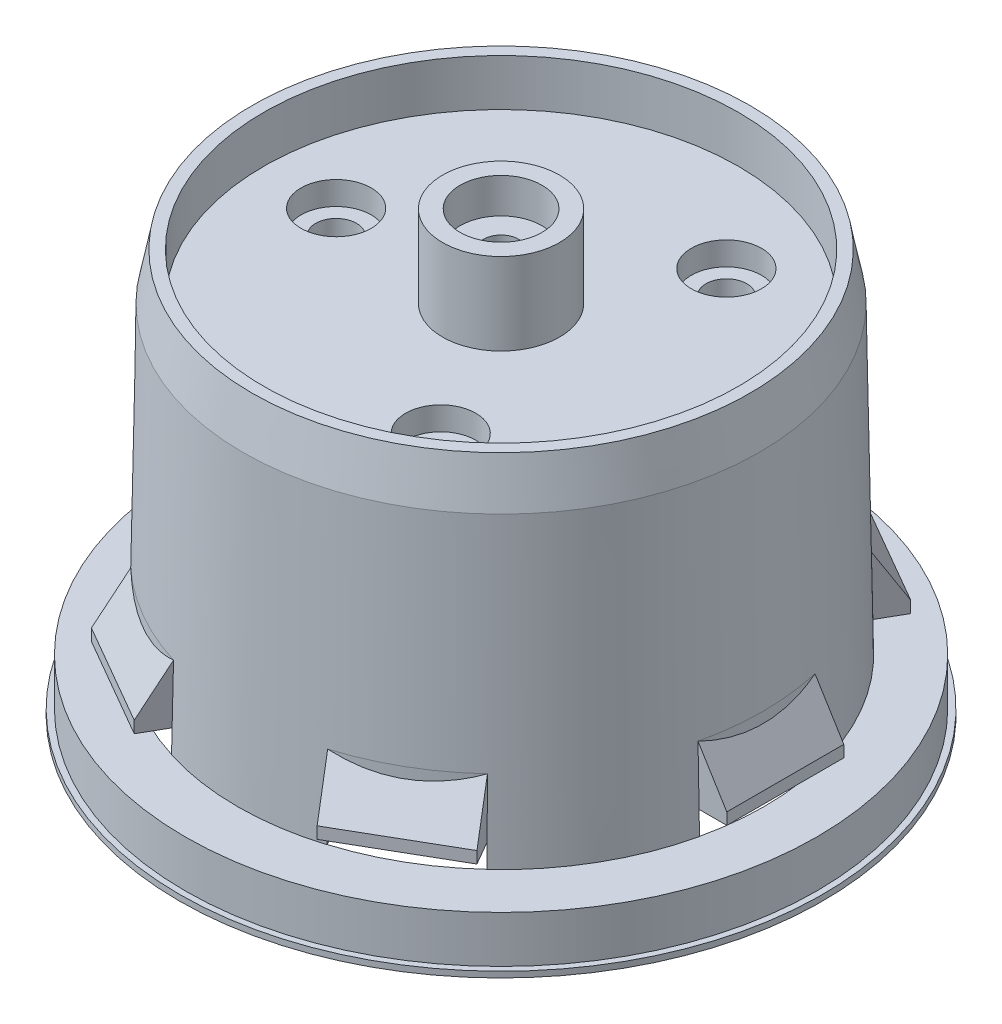
from build123d import *

# Parameters (mm, degrees)
SCHIZZO1_R                    = 22
ESTRUSIONE_ESTRUSIONE1_DEPTH  = 30
SFORMO1_ANGLE                 = 1
SMUSSO1_SIZE                  = 4
SMUSSO1_SIZE2                 = 0.707593191
SCHIZZO2_R                    = 20.292406809
TAGLIO_ESTRUSIONE1_DEPTH      = 4
SVUOTA1_T                     = -3
SCHIZZO4_R                    = 3
TAGLIO_ESTRUSIONE2_DEPTH      = 2
SCHIZZO5_R                    = 1.75
TAGLIO_ESTRUSIONE3_DEPTH      = 40.882700437
RIPETIZIONECIRCOLARE1_COUNT   = 3
SCHIZZO3_R                    = 5
ESTRUSIONE_ESTRUSIONE2_DEPTH  = 7
SCHIZZO6_R                    = 3.5
TAGLIO_ESTRUSIONE5_DEPTH      = 3
SCHIZZO8_W                    = 1
SCHIZZO8_H                    = 40.584813618
ESTRUSIONE_SOTTILE1_DEPTH     = 8
SCHIZZO7_R                    = 2.5
SCHIZZO7_R_2                  = 1.5
ESTRUSIONE_ESTRUSIONE5_DEPTH  = 17
SCHIZZO10_R                   = 1.5
TAGLIO_ESTRUSIONE7_DEPTH      = 44.75648295
SCHIZZO11_R                   = 0.75
ESTRUSIONE_ESTRUSIONE6_DEPTH  = 8
RIPETIZIONECIRCOLARE2_COUNT   = 6
SCHIZZO12_R                   = 3.5
SCHIZZO12_R_2                 = 1.75
ESTRUSIONE_ESTRUSIONE7_DEPTH  = 5
TAGLIO_ESTRUSIONE8_START      = -1.5
SCHIZZO13_R                   = 3
TAGLIO_ESTRUSIONE8_DEPTH      = 1.5
RIPETIZIONECIRCOLARE3_COUNT   = 3
SCHIZZO14_R                   = 27
SCHIZZO14_R_2                 = 22.5
ESTRUSIONE_ESTRUSIONE8_DEPTH  = 4
SCHIZZO16_R                   = 27.5
SCHIZZO16_R_2                 = 26.5
ESTRUSIONE_ESTRUSIONE9_DEPTH  = 0.5
SCHIZZO17_W                   = 2
SCHIZZO17_H                   = 10
TAGLIO_ESTRUSIONE9_DEPTH      = 4
SCHIZZO18_W                   = 5
SCHIZZO18_H                   = 10
ESTRUSIONE_ESTRUSIONE10_DEPTH = 2
TAGLIO_ESTRUSIONE10_DEPTH     = 10
ESTRUSIONE_ESTRUSIONE11_DEPTH = 1
RIPETIZIONECIRCOLARE11_COUNT  = 6


with BuildPart() as part:
    # Schizzo1 → Estrusione-Estrusione1 (new body)
    with BuildSketch(Plane(origin=(0, 0, 0), x_dir=(1, 0, 0), z_dir=(0, 1, 0))):
        with Locations(Location((0, 0, 0), (0, 0, 270))):
            Circle(SCHIZZO1_R)
    extrude(amount=ESTRUSIONE_ESTRUSIONE1_DEPTH)

    # Sformo1
    sformo1_faces = [part.faces().sort_by_distance(p)[0] for p in [
        (0, 15, -22),
    ]]
    draft(sformo1_faces, Plane.ZX.offset(30), SFORMO1_ANGLE)

    # Smusso1
    smusso1_edges = [part.edges().sort_by_distance(p)[0] for p in [
        (0, 30, -22),
    ]]
    smusso1_side = [part.faces().sort_by_distance(p)[0] for p in [
        (0, 15, -22.261825974),
    ]]
    chamfer(smusso1_edges, length=SMUSSO1_SIZE, length2=SMUSSO1_SIZE2, reference=smusso1_side[0])

    # Schizzo2 → Taglio-Estrusione1 (cut)
    with BuildSketch(Plane(origin=(0, 30, 0), x_dir=(1, 0, 0), z_dir=(0, 1, 0))):
        with Locations(Location((0, 0, 0), (0, 0, 270))):
            Circle(SCHIZZO2_R)
    extrude(amount=-TAGLIO_ESTRUSIONE1_DEPTH, mode=Mode.SUBTRACT)

    # Svuota1
    svuota1_openings = [part.faces().sort_by_distance(p)[0] for p in [
        (0, 0, 0),
    ]]
    offset(amount=SVUOTA1_T, openings=svuota1_openings, kind=Kind.INTERSECTION)

    # Schizzo4 → Taglio-Estrusione2 (cut)
    with BuildSketch(Plane(origin=(0, 26, 0), x_dir=(1, 0, 0), z_dir=(0, 1, 0))):
        with Locations(Location((7.05, 12.210958193, 0), (0, 0, 270))):
            Circle(SCHIZZO4_R)
    taglio_estrusione2 = extrude(amount=-TAGLIO_ESTRUSIONE2_DEPTH, mode=Mode.SUBTRACT)

    # Schizzo5 → Taglio-Estrusione3 (cut, through all)
    with BuildSketch(Plane(origin=(0, 24, 0), x_dir=(1, 0, 0), z_dir=(0, 1, 0))):
        with Locations(Location((7.05, 12.210958193, 0), (0, 0, 270))):
            Circle(SCHIZZO5_R)
    taglio_estrusione3 = extrude(amount=-TAGLIO_ESTRUSIONE3_DEPTH, mode=Mode.SUBTRACT)

    # RipetizioneCircolare1: Taglio-Estrusione2, Taglio-Estrusione3 ×3 about axis
    ripetizionecircolare1_axis = Axis((0, 0, 0), (0, 1, 0))
    add([taglio_estrusione2.rotate(ripetizionecircolare1_axis, i * 360 / RIPETIZIONECIRCOLARE1_COUNT) for i in range(1, RIPETIZIONECIRCOLARE1_COUNT)], mode=Mode.SUBTRACT)
    add([taglio_estrusione3.rotate(ripetizionecircolare1_axis, i * 360 / RIPETIZIONECIRCOLARE1_COUNT) for i in range(1, RIPETIZIONECIRCOLARE1_COUNT)], mode=Mode.SUBTRACT)

    # Schizzo3 → Estrusione-Estrusione2 (add)
    with BuildSketch(Plane(origin=(0, 26, 0), x_dir=(1, 0, 0), z_dir=(0, 1, 0))):
        with Locations(Location((0, 0, 0), (0, 0, 270))):
            Circle(SCHIZZO3_R)
    extrude(amount=ESTRUSIONE_ESTRUSIONE2_DEPTH)

    # Schizzo6 → Taglio-Estrusione5 (cut)
    with BuildSketch(Plane(origin=(0, 33, 0), x_dir=(1, 0, 0), z_dir=(0, 1, 0))):
        with Locations(Location((0, 0, 0), (0, 0, 270))):
            Circle(SCHIZZO6_R)
    extrude(amount=-TAGLIO_ESTRUSIONE5_DEPTH, mode=Mode.SUBTRACT)

    # Schizzo8 → Estrusione-Sottile1 (add)
    with BuildSketch(Plane.XZ.offset(-23)):
        Polygon((-17.323739801, -10.579216107), (17.823739801, 9.713190703), (17.323739801, 10.579216107), (-17.823739801, -9.713190703), align=None)
        Rectangle(SCHIZZO8_W, SCHIZZO8_H)
        Polygon((17.823739801, -9.713190703), (-17.323739801, 10.579216107), (-17.823739801, 9.713190703), (17.323739801, -10.579216107), align=None)
    extrude(amount=ESTRUSIONE_SOTTILE1_DEPTH)

    # Schizzo7 → Estrusione-Estrusione5 (add)
    with BuildSketch(Plane(origin=(0, 30, 0), x_dir=(1, 0, 0), z_dir=(0, 1, 0))):
        with Locations(Location((0, 0, 0), (0, 0, 270))):
            Circle(SCHIZZO7_R)
        with Locations(Location((0, 0, 0), (0, 0, 270))):
            Circle(SCHIZZO7_R_2, mode=Mode.SUBTRACT)
    extrude(amount=-ESTRUSIONE_ESTRUSIONE5_DEPTH)

    # Schizzo10 → Taglio-Estrusione7 (cut, through all)
    with BuildSketch(Plane(origin=(0, 30, 0), x_dir=(1, 0, 0), z_dir=(0, 1, 0))):
        with Locations(Location((0, 0, 0), (0, 0, 270))):
            Circle(SCHIZZO10_R)
    extrude(amount=-TAGLIO_ESTRUSIONE7_DEPTH, mode=Mode.SUBTRACT)

    # Schizzo11 → Estrusione-Estrusione6 (add)
    with BuildSketch(Plane.XZ.offset(-15)):
        with Locations((0, -10.852183983)):
            Circle(SCHIZZO11_R)
    estrusione_estrusione6 = extrude(amount=-ESTRUSIONE_ESTRUSIONE6_DEPTH)

    # RipetizioneCircolare2: Estrusione-Estrusione6 ×6 about axis
    ripetizionecircolare2_axis = Axis((0, 0, 0), (0, 1, 0))
    for i in range(1, RIPETIZIONECIRCOLARE2_COUNT):
        add(estrusione_estrusione6.rotate(ripetizionecircolare2_axis, i * 360 / RIPETIZIONECIRCOLARE2_COUNT))

    # Schizzo12 → Estrusione-Estrusione7 (add)
    with BuildSketch(Plane.XZ.offset(-23)):
        with Locations(Location((7.05, -12.210958193, 0), (0, 0, 90))):
            Circle(SCHIZZO12_R)
        with Locations(Location((7.05, -12.210958193, 0), (0, 0, 90))):
            Circle(SCHIZZO12_R_2, mode=Mode.SUBTRACT)
    estrusione_estrusione7 = extrude(amount=ESTRUSIONE_ESTRUSIONE7_DEPTH)

    # Schizzo13 → Taglio-Estrusione8 (cut)
    with BuildSketch(Plane.XZ.offset(-18).offset(TAGLIO_ESTRUSIONE8_START)):
        with Locations(Location((7.05, -12.210958193, 0), (0, 0, 90))):
            Circle(SCHIZZO13_R)
    taglio_estrusione8 = extrude(amount=TAGLIO_ESTRUSIONE8_DEPTH, mode=Mode.SUBTRACT)

    # RipetizioneCircolare3: Estrusione-Estrusione7, Taglio-Estrusione8 ×3 about axis
    ripetizionecircolare3_axis = Axis((0, 0, 0), (0, 1, 0))
    add([estrusione_estrusione7.rotate(ripetizionecircolare3_axis, i * 360 / RIPETIZIONECIRCOLARE3_COUNT) for i in range(1, RIPETIZIONECIRCOLARE3_COUNT)])
    add([taglio_estrusione8.rotate(ripetizionecircolare3_axis, i * 360 / RIPETIZIONECIRCOLARE3_COUNT) for i in range(1, RIPETIZIONECIRCOLARE3_COUNT)], mode=Mode.SUBTRACT)

    # Schizzo14 → Estrusione-Estrusione8 (add)
    with BuildSketch(Plane.XZ):
        with Locations(Location((0, 0, 0), (0, 0, 270))):
            Circle(SCHIZZO14_R)
        with Locations(Location((0, 0, 0), (0, 0, 270))):
            Circle(SCHIZZO14_R_2, mode=Mode.SUBTRACT)
    extrude(amount=ESTRUSIONE_ESTRUSIONE8_DEPTH)

    # Schizzo16 → Estrusione-Estrusione9 (add)
    with BuildSketch(Plane.XZ.offset(4)):
        with Locations(Location((0, 0, 0), (0, 0, 270))):
            Circle(SCHIZZO16_R)
        with Locations(Location((0, 0, 0), (0, 0, 270))):
            Circle(SCHIZZO16_R_2, mode=Mode.SUBTRACT)
    extrude(amount=ESTRUSIONE_ESTRUSIONE9_DEPTH)

    # Schizzo17 → Taglio-Estrusione9 (cut, symmetric)
    with BuildSketch(Plane(origin=(11.148365393, 0, -19.309535283), x_dir=(0, 1, 0), z_dir=(0.499999999999998, 0, -0.8660254037844398))):
        with Locations((1, 0)):
            Rectangle(SCHIZZO17_W, SCHIZZO17_H)
    taglio_estrusione9 = extrude(amount=TAGLIO_ESTRUSIONE9_DEPTH, both=True, mode=Mode.SUBTRACT)

    # Schizzo18 → Estrusione-Estrusione10 (add, symmetric)
    with BuildSketch(Plane(origin=(11.148365393, 0, -19.309535283), x_dir=(0, 1, 0), z_dir=(0.499999999999998, 0, -0.8660254037844398))):
        with Locations((4.5, 0)):
            Rectangle(SCHIZZO18_W, SCHIZZO18_H)
    estrusione_estrusione10 = extrude(amount=ESTRUSIONE_ESTRUSIONE10_DEPTH, both=True)

    # Schizzo19 → Taglio-Estrusione10 (cut)
    with BuildSketch(Plane(origin=(-4.330127019, 0, -2.5), x_dir=(-0.4999999999999981, 0, 0.8660254037844397), z_dir=(-0.8660254037844397, 0, -0.4999999999999981))):
        Polygon((-21.836339003, 7), (-24.296730787, 3), (-24.296730787, 7), align=None)
    taglio_estrusione10 = extrude(amount=-TAGLIO_ESTRUSIONE10_DEPTH, mode=Mode.SUBTRACT)

    # Schizzo20 → Estrusione-Estrusione11 (add)
    with BuildSketch(Plane.XZ.offset(-7)):
        with BuildLine():
            Line((15.24829652, -16.410824302), (6.588042483, -21.410824302))
            ThreePointArc((6.588042483, -21.410824302), (11.200733247, -19.400239065), (15.24829652, -16.410824302))
        make_face()
    estrusione_estrusione11 = extrude(amount=ESTRUSIONE_ESTRUSIONE11_DEPTH)

    # RipetizioneCircolare11: Taglio-Estrusione9, Estrusione-Estrusione10, Taglio-Estrusione10, Estrusione-Estrusione11 ×6 about axis
    ripetizionecircolare11_axis = Axis((0, 0, 0), (0, 1, 0))
    add([taglio_estrusione9.rotate(ripetizionecircolare11_axis, i * 360 / RIPETIZIONECIRCOLARE11_COUNT) for i in range(1, RIPETIZIONECIRCOLARE11_COUNT)], mode=Mode.SUBTRACT)
    add([estrusione_estrusione10.rotate(ripetizionecircolare11_axis, i * 360 / RIPETIZIONECIRCOLARE11_COUNT) for i in range(1, RIPETIZIONECIRCOLARE11_COUNT)])
    add([taglio_estrusione10.rotate(ripetizionecircolare11_axis, i * 360 / RIPETIZIONECIRCOLARE11_COUNT) for i in range(1, RIPETIZIONECIRCOLARE11_COUNT)], mode=Mode.SUBTRACT)
    add([estrusione_estrusione11.rotate(ripetizionecircolare11_axis, i * 360 / RIPETIZIONECIRCOLARE11_COUNT) for i in range(1, RIPETIZIONECIRCOLARE11_COUNT)])


solid = part.part
